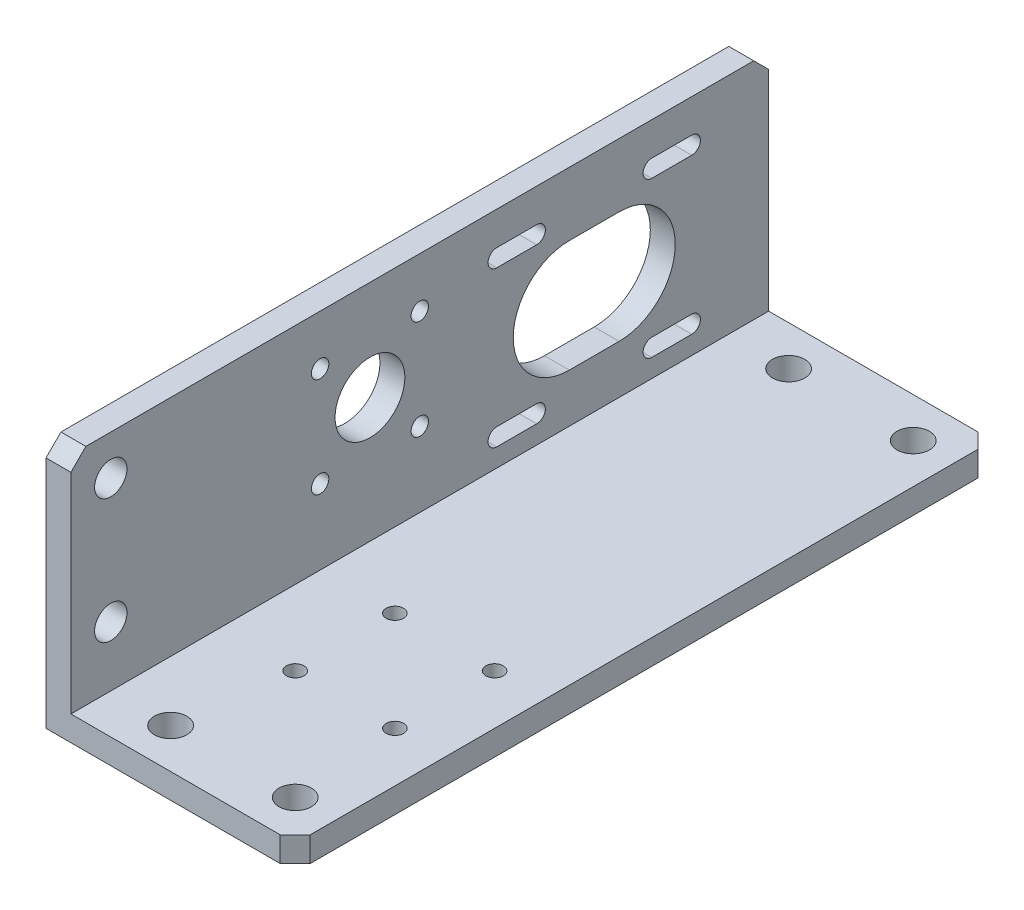
from build123d import *

# Parameters (mm, degrees)
ESTRUSIONE_ESTRUSIONE1_DEPTH = 140
FORO_6_5_6_5_1_D             = 6.5
FORO_6_5_6_5_2_D             = 6.5
FORO_6_5_6_5_2_DEPTH         = 5
FORO_6_5_6_5_2_TIP           = 1.952797012
TAGLIO_ESTRUSIONE3_REACH     = 158.844
SCHIZZO10_R                  = 1.75
SCHIZZO10_R_2                = 7
TAGLIO_ESTRUSIONE4_REACH     = 158.844
SCHIZZO11_R                  = 1.75
TAGLIO_ESTRUSIONE6_REACH     = 158.844
SMUSSO1_SIZE                 = 3


with BuildPart() as part:
    # Schizzo1 → Estrusione-Estrusione1 (new body)
    with BuildSketch(Plane.XY):
        Polygon((0, 0), (0, 50), (5, 50), (5, 5), (50, 5), (50, 0), align=None)
    extrude(amount=ESTRUSIONE_ESTRUSIONE1_DEPTH)

    # Foro Ø6.5 (6.5)-1 (through all)
    with Locations(Plane(origin=(0, 0, 0), x_dir=(-1, 0, 0), z_dir=(0, -1, 0))):
        with Locations((-17, -132), (-42, -132)):
            foro_6_5_6_5_1 = Hole(FORO_6_5_6_5_1_D / 2)

    # Foro Ø6.5 (6.5)-2
    with Locations(Plane.ZY):
        with Locations((132, 42), (132, 17)):
            Hole(FORO_6_5_6_5_2_D / 2, depth=FORO_6_5_6_5_2_DEPTH)
            with Locations((0, 0, -(FORO_6_5_6_5_2_DEPTH + FORO_6_5_6_5_2_TIP / 2))):  # 118° drill point
                Cone(0, FORO_6_5_6_5_2_D / 2, FORO_6_5_6_5_2_TIP, mode=Mode.SUBTRACT)

    # Specchia1: Foro Ø6.5 (6.5)-1 across plane
    add(foro_6_5_6_5_1.mirror(Plane.XY.offset(70)), mode=Mode.SUBTRACT)

    # Schizzo10 → Taglio-Estrusione3 (cut, up to next)
    with BuildSketch(Plane.ZY, mode=Mode.PRIVATE) as taglio_estrusione3_sk1:
        with Locations((70, 40)):
            Circle(SCHIZZO10_R)
    taglio_estrusione3_tool1 = extrude(taglio_estrusione3_sk1.sketch, amount=-TAGLIO_ESTRUSIONE3_REACH, mode=Mode.PRIVATE) & part.part
    # Schizzo10 → Taglio-Estrusione3 (cut, up to next)
    with BuildSketch(Plane.ZY, mode=Mode.PRIVATE) as taglio_estrusione3_sk2:
        with Locations((90, 40)):
            Circle(SCHIZZO10_R)
    taglio_estrusione3_tool2 = extrude(taglio_estrusione3_sk2.sketch, amount=-TAGLIO_ESTRUSIONE3_REACH, mode=Mode.PRIVATE) & part.part
    # Schizzo10 → Taglio-Estrusione3 (cut, up to next)
    with BuildSketch(Plane.ZY, mode=Mode.PRIVATE) as taglio_estrusione3_sk3:
        with Locations((90, 20)):
            Circle(SCHIZZO10_R)
    taglio_estrusione3_tool3 = extrude(taglio_estrusione3_sk3.sketch, amount=-TAGLIO_ESTRUSIONE3_REACH, mode=Mode.PRIVATE) & part.part
    # Schizzo10 → Taglio-Estrusione3 (cut, up to next)
    with BuildSketch(Plane.ZY, mode=Mode.PRIVATE) as taglio_estrusione3_sk4:
        with Locations((70, 20)):
            Circle(SCHIZZO10_R)
    taglio_estrusione3_tool4 = extrude(taglio_estrusione3_sk4.sketch, amount=-TAGLIO_ESTRUSIONE3_REACH, mode=Mode.PRIVATE) & part.part
    # Schizzo10 → Taglio-Estrusione3 (cut, up to next)
    with BuildSketch(Plane.ZY, mode=Mode.PRIVATE) as taglio_estrusione3_sk5:
        with Locations((80, 30)):
            Circle(SCHIZZO10_R_2)
    taglio_estrusione3_tool5 = extrude(taglio_estrusione3_sk5.sketch, amount=-TAGLIO_ESTRUSIONE3_REACH, mode=Mode.PRIVATE) & part.part
    add(taglio_estrusione3_tool1.solids().sort_by_distance((0, 40, 70))[0], mode=Mode.SUBTRACT)
    add(taglio_estrusione3_tool2.solids().sort_by_distance((0, 40, 90))[0], mode=Mode.SUBTRACT)
    add(taglio_estrusione3_tool3.solids().sort_by_distance((0, 20, 90))[0], mode=Mode.SUBTRACT)
    add(taglio_estrusione3_tool4.solids().sort_by_distance((0, 20, 70))[0], mode=Mode.SUBTRACT)
    add(taglio_estrusione3_tool5.solids().sort_by_distance((0, 30, 80))[0], mode=Mode.SUBTRACT)

    # Schizzo11 → Taglio-Estrusione4 (cut, up to next)
    with BuildSketch(Plane.XZ, mode=Mode.PRIVATE) as taglio_estrusione4_sk1:
        with Locations((20, 90)):
            Circle(SCHIZZO11_R)
    taglio_estrusione4_tool1 = extrude(taglio_estrusione4_sk1.sketch, amount=-TAGLIO_ESTRUSIONE4_REACH, mode=Mode.PRIVATE) & part.part
    # Schizzo11 → Taglio-Estrusione4 (cut, up to next)
    with BuildSketch(Plane.XZ, mode=Mode.PRIVATE) as taglio_estrusione4_sk2:
        with Locations((20, 110)):
            Circle(SCHIZZO11_R)
    taglio_estrusione4_tool2 = extrude(taglio_estrusione4_sk2.sketch, amount=-TAGLIO_ESTRUSIONE4_REACH, mode=Mode.PRIVATE) & part.part
    # Schizzo11 → Taglio-Estrusione4 (cut, up to next)
    with BuildSketch(Plane.XZ, mode=Mode.PRIVATE) as taglio_estrusione4_sk3:
        with Locations((40, 110)):
            Circle(SCHIZZO11_R)
    taglio_estrusione4_tool3 = extrude(taglio_estrusione4_sk3.sketch, amount=-TAGLIO_ESTRUSIONE4_REACH, mode=Mode.PRIVATE) & part.part
    # Schizzo11 → Taglio-Estrusione4 (cut, up to next)
    with BuildSketch(Plane.XZ, mode=Mode.PRIVATE) as taglio_estrusione4_sk4:
        with Locations((40, 90)):
            Circle(SCHIZZO11_R)
    taglio_estrusione4_tool4 = extrude(taglio_estrusione4_sk4.sketch, amount=-TAGLIO_ESTRUSIONE4_REACH, mode=Mode.PRIVATE) & part.part
    add(taglio_estrusione4_tool1.solids().sort_by_distance((20, 0, 90))[0], mode=Mode.SUBTRACT)
    add(taglio_estrusione4_tool2.solids().sort_by_distance((20, 0, 110))[0], mode=Mode.SUBTRACT)
    add(taglio_estrusione4_tool3.solids().sort_by_distance((40, 0, 110))[0], mode=Mode.SUBTRACT)
    add(taglio_estrusione4_tool4.solids().sort_by_distance((40, 0, 90))[0], mode=Mode.SUBTRACT)

    # Schizzo13 → Taglio-Estrusione6 (cut, up to next)
    with BuildSketch(Plane.ZY, mode=Mode.PRIVATE) as taglio_estrusione6_sk1:
        with BuildLine():
            Line((15.443650814, 43.306349186), (23.443650814, 43.306349186))
            ThreePointArc((23.443650814, 43.306349186), (25.193650814, 41.556349186), (23.443650814, 39.806349186))
            Line((23.443650814, 39.806349186), (15.443650814, 39.806349186))
            ThreePointArc((15.443650814, 39.806349186), (13.693650814, 41.556349186), (15.443650814, 43.306349186))
        make_face()
    taglio_estrusione6_tool1 = extrude(taglio_estrusione6_sk1.sketch, amount=-TAGLIO_ESTRUSIONE6_REACH, mode=Mode.PRIVATE) & part.part
    # Schizzo13 → Taglio-Estrusione6 (cut, up to next)
    with BuildSketch(Plane.ZY, mode=Mode.PRIVATE) as taglio_estrusione6_sk2:
        with BuildLine():
            Line((15.443650814, 8.693650814), (23.443650814, 8.693650814))
            ThreePointArc((23.443650814, 8.693650814), (25.193650814, 10.443650814), (23.443650814, 12.193650814))
            Line((23.443650814, 12.193650814), (15.443650814, 12.193650814))
            ThreePointArc((15.443650814, 12.193650814), (13.693650814, 10.443650814), (15.443650814, 8.693650814))
        make_face()
    taglio_estrusione6_tool2 = extrude(taglio_estrusione6_sk2.sketch, amount=-TAGLIO_ESTRUSIONE6_REACH, mode=Mode.PRIVATE) & part.part
    # Schizzo13 → Taglio-Estrusione6 (cut, up to next)
    with BuildSketch(Plane.ZY, mode=Mode.PRIVATE) as taglio_estrusione6_sk3:
        with BuildLine():
            Line((54.556349186, 43.306349186), (46.556349186, 43.306349186))
            ThreePointArc((46.556349186, 43.306349186), (44.806349186, 41.556349186), (46.556349186, 39.806349186))
            Line((46.556349186, 39.806349186), (54.556349186, 39.806349186))
            ThreePointArc((54.556349186, 39.806349186), (56.306349186, 41.556349186), (54.556349186, 43.306349186))
        make_face()
    taglio_estrusione6_tool3 = extrude(taglio_estrusione6_sk3.sketch, amount=-TAGLIO_ESTRUSIONE6_REACH, mode=Mode.PRIVATE) & part.part
    # Schizzo13 → Taglio-Estrusione6 (cut, up to next)
    with BuildSketch(Plane.ZY, mode=Mode.PRIVATE) as taglio_estrusione6_sk4:
        with BuildLine():
            Line((54.556349186, 8.693650814), (46.556349186, 8.693650814))
            ThreePointArc((46.556349186, 8.693650814), (44.806349186, 10.443650814), (46.556349186, 12.193650814))
            Line((46.556349186, 12.193650814), (54.556349186, 12.193650814))
            ThreePointArc((54.556349186, 12.193650814), (56.306349186, 10.443650814), (54.556349186, 8.693650814))
        make_face()
    taglio_estrusione6_tool4 = extrude(taglio_estrusione6_sk4.sketch, amount=-TAGLIO_ESTRUSIONE6_REACH, mode=Mode.PRIVATE) & part.part
    # Schizzo13 → Taglio-Estrusione6 (cut, up to next)
    with BuildSketch(Plane.ZY, mode=Mode.PRIVATE) as taglio_estrusione6_sk5:
        with BuildLine():
            Line((40, 14.75), (30, 14.75))
            ThreePointArc((30, 14.75), (18.75, 26), (30, 37.25))
            Line((30, 37.25), (40, 37.25))
            ThreePointArc((40, 37.25), (51.25, 26), (40, 14.75))
        make_face()
    taglio_estrusione6_tool5 = extrude(taglio_estrusione6_sk5.sketch, amount=-TAGLIO_ESTRUSIONE6_REACH, mode=Mode.PRIVATE) & part.part
    add(taglio_estrusione6_tool1.solids().sort_by_distance((0, 41.556349, 19.443651))[0], mode=Mode.SUBTRACT)
    add(taglio_estrusione6_tool2.solids().sort_by_distance((0, 10.443651, 19.443651))[0], mode=Mode.SUBTRACT)
    add(taglio_estrusione6_tool3.solids().sort_by_distance((0, 41.556349, 50.556349))[0], mode=Mode.SUBTRACT)
    add(taglio_estrusione6_tool4.solids().sort_by_distance((0, 10.443651, 50.556349))[0], mode=Mode.SUBTRACT)
    add(taglio_estrusione6_tool5.solids().sort_by_distance((0, 26, 35))[0], mode=Mode.SUBTRACT)

    # Smusso1
    smusso1_edges = [part.edges().sort_by_distance(p)[0] for p in [
        (2.5, 50, 140),
        (2.5, 50, 0),
        (50, 2.5, 140),
        (50, 2.5, 0),
    ]]
    chamfer(smusso1_edges, length=SMUSSO1_SIZE)


solid = part.part
